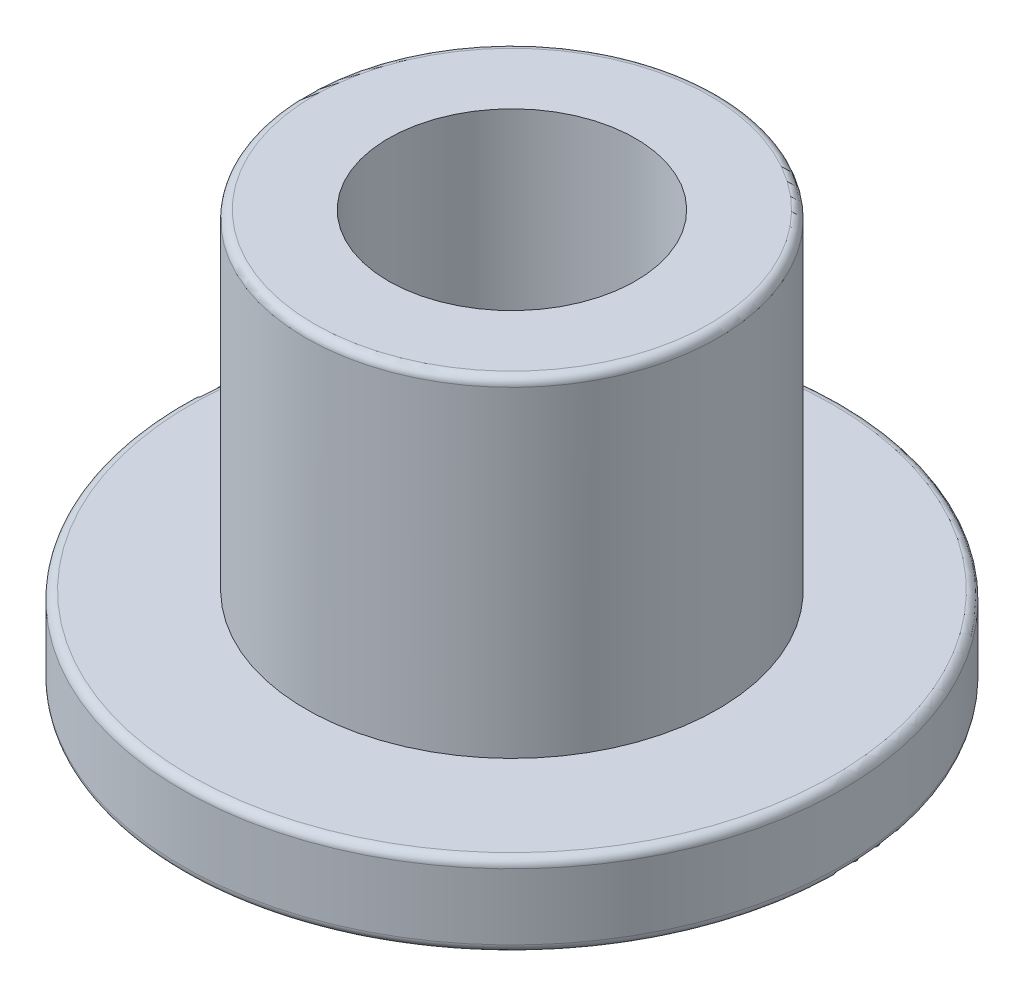
from build123d import *

# Parameters (mm, degrees)
SKETCH_1_R      = 5
SKETCH_1_R_2    = 3
EXTRUDE_1_DEPTH = 5
SKETCH_2_R      = 8
SKETCH_2_R_2    = 5
EXTRUDE_2_DEPTH = 2
FILLET_1_R      = 0.2


with BuildPart() as part:
    # 草图1 → 凸台-拉伸1 (new, symmetric)
    with BuildSketch(Plane(origin=(0, 0, 0), x_dir=(1, 0, 0), z_dir=(0, 1, 0))):
        with Locations(Location((0, 0, 0), (0, 0, 270))):
            Circle(SKETCH_1_R)
        with Locations(Location((0, 0, 0), (0, 0, 270))):
            Circle(SKETCH_1_R_2, mode=Mode.SUBTRACT)
    extrude(amount=EXTRUDE_1_DEPTH, both=True)


with BuildPart() as body_2:
    # 草图2 → 凸台-拉伸2 (new body)
    with BuildSketch(Plane.XZ.offset(5)):
        with Locations(Location((0, 0, 0), (0, 0, 270))):
            Circle(SKETCH_2_R)
        with Locations(Location((0, 0, 0), (0, 0, 90))):
            Circle(SKETCH_2_R_2, mode=Mode.SUBTRACT)
    extrude(amount=-EXTRUDE_2_DEPTH)

    # Combine 1: union part
    add(part.part)

    # 圆角1
    fillet_1_edges = [body_2.edges().sort_by_distance(p)[0] for p in [
        (0, 5, -5),
        (0, -5, 8),
        (0, -3, 8),
    ]]
    fillet(fillet_1_edges, radius=FILLET_1_R)


solid = body_2.part
